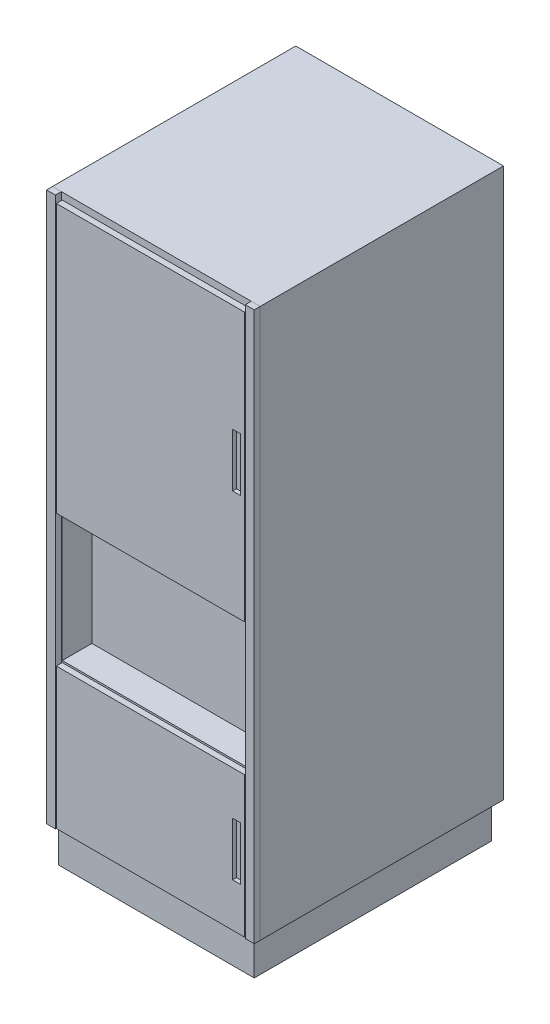
from build123d import *

# Parameters (mm, degrees)
SKETCH1_W                 = 700
SKETCH1_H                 = 1850
GOVDE_KASA_DEPTH          = 820
SKETCH2_W                 = 660
SKETCH2_H                 = 120
PLINT_DEPTH               = 800
SKETCH3_W                 = 30
SKETCH3_H                 = 1850
SOVE_SOL_DEPTH            = 20
SKETCH4_W                 = 30
SKETCH4_H                 = 1850
SOVE_SAG_DEPTH            = 20
SKETCH5_W                 = 634
SKETCH5_H                 = 904
KAPI_SARJOR_DEPTH         = 20
KAPI_SARJOR_KULP_START    = 7
SKETCH6_W                 = 26
SKETCH6_H                 = 180
KAPI_SARJOR_KULP_DEPTH    = 13
SKETCH7_W                 = 634
SKETCH7_H                 = 434
ACIKLIK_KUTULAMA_DEPTH    = 100
SKETCH8_W                 = 634
SKETCH8_H                 = 474
KAPAK_PANO_MEK_DEPTH      = 20
KAPAK_PANO_MEK_KULP_START = 7
SKETCH9_W                 = 26
SKETCH9_H                 = 180
KAPAK_PANO_MEK_KULP_DEPTH = 13


with BuildPart() as part:
    # Sketch1 → govde_kasa (new body)
    with BuildSketch(Plane.XY):
        with Locations((350, 1045)):
            Rectangle(SKETCH1_W, SKETCH1_H)
    extrude(amount=-GOVDE_KASA_DEPTH)

    # Sketch7 → aciklik_kutulama (cut)
    with BuildSketch(Plane.XY):
        with Locations((350, 820)):
            Rectangle(SKETCH7_W, SKETCH7_H)
    extrude(amount=-ACIKLIK_KUTULAMA_DEPTH, mode=Mode.SUBTRACT)


with BuildPart() as body_2:
    # Sketch2 → plint (new body)
    with BuildSketch(Plane.XY):
        with Locations((350, 60)):
            Rectangle(SKETCH2_W, SKETCH2_H)
    extrude(amount=-PLINT_DEPTH)


with BuildPart() as body_3:
    # Sketch3 → sove_sol (new body)
    with BuildSketch(Plane.XY):
        with Locations((15, 1045)):
            Rectangle(SKETCH3_W, SKETCH3_H)
    extrude(amount=SOVE_SOL_DEPTH)


with BuildPart() as body_4:
    # Sketch4 → sove_sag (new body)
    with BuildSketch(Plane.XY):
        with Locations((685, 1045)):
            Rectangle(SKETCH4_W, SKETCH4_H)
    extrude(amount=SOVE_SAG_DEPTH)


with BuildPart() as body_5:
    # Sketch5 → kapi_sarjor (new body)
    with BuildSketch(Plane.XY):
        with Locations((350, 1495)):
            Rectangle(SKETCH5_W, SKETCH5_H)
    extrude(amount=KAPI_SARJOR_DEPTH)

    # Sketch6 → kapi_sarjor_kulp (cut)
    with BuildSketch(Plane.XY.offset(KAPI_SARJOR_KULP_START)):
        with Locations((640, 1495)):
            Rectangle(SKETCH6_W, SKETCH6_H)
    extrude(amount=KAPI_SARJOR_KULP_DEPTH, mode=Mode.SUBTRACT)


with BuildPart() as body_6:
    # Sketch8 → kapak_pano_mek (new body)
    with BuildSketch(Plane.XY):
        with Locations((350, 360)):
            Rectangle(SKETCH8_W, SKETCH8_H)
    extrude(amount=KAPAK_PANO_MEK_DEPTH)

    # Sketch9 → kapak_pano_mek_kulp (cut)
    with BuildSketch(Plane.XY.offset(KAPAK_PANO_MEK_KULP_START)):
        with Locations((640, 360)):
            Rectangle(SKETCH9_W, SKETCH9_H)
    extrude(amount=KAPAK_PANO_MEK_KULP_DEPTH, mode=Mode.SUBTRACT)


solid = Compound([part.part, body_2.part, body_3.part, body_4.part, body_5.part, body_6.part])
